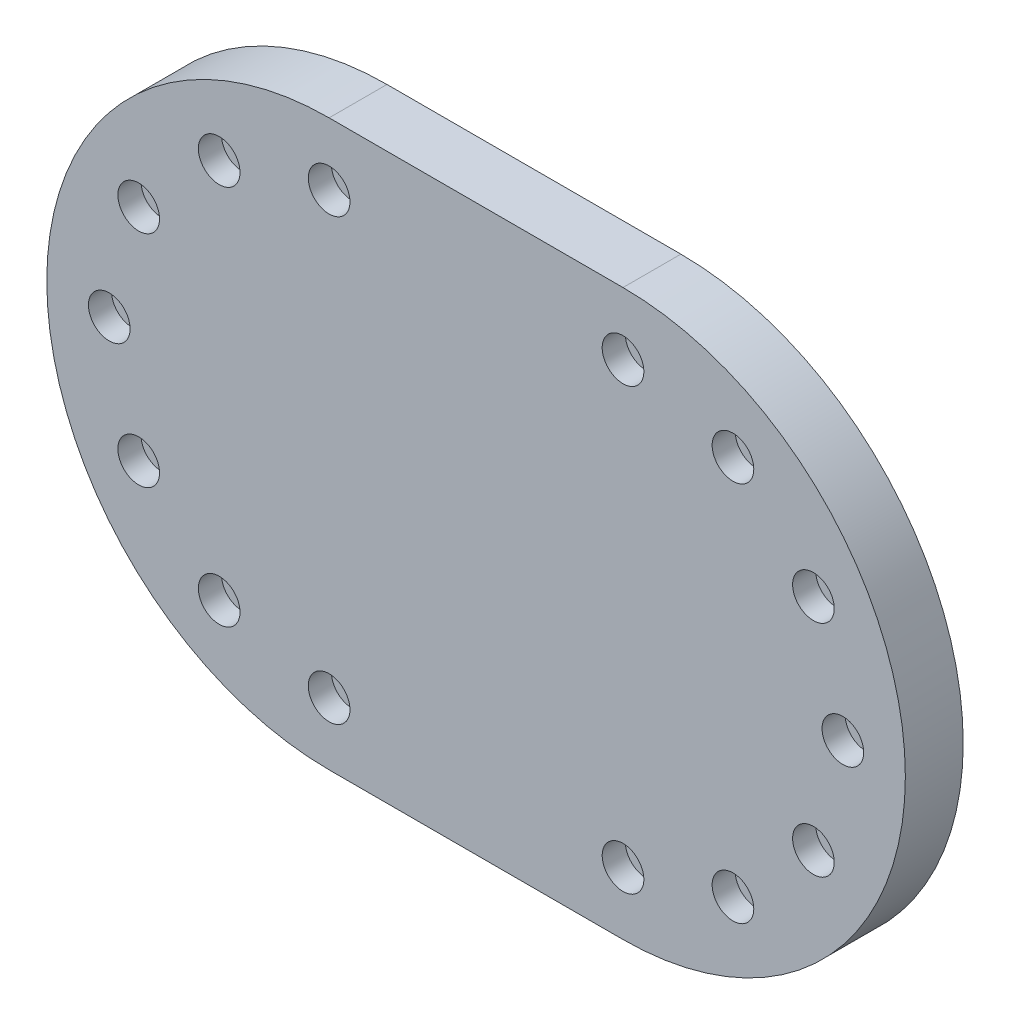
from build123d import *

# Parameters (mm, degrees)
RESSALTO_EXTRUS_O4_DEPTH = 12.5
CORTE_EXTRUS_O2_DEPTH    = 6.25
FURO5_D                  = 5
FURO5_CBORE_D            = 9
FURO5_CBORE_DEPTH        = 5
PADR_OCIRCULAR3_COUNT    = 7
PADR_OCIRCULAR3_ANGLE    = 180
FURO6_D                  = 5
FURO6_CBORE_D            = 9
FURO6_CBORE_DEPTH        = 5
PADR_OCIRCULAR4_COUNT    = 7
PADR_OCIRCULAR4_ANGLE    = 180


with BuildPart() as part:
    # Esboço1 → Ressalto-extrusão4 (new body)
    with BuildSketch(Plane.XY):
        with BuildLine():
            Line((31.75, 61), (-31.75, 61))
            ThreePointArc((-31.75, 61), (-92.75, 0), (-31.75, -61))
            Line((-31.75, -61), (31.75, -61))
            ThreePointArc((31.75, -61), (92.75, 0), (31.75, 61))
        make_face()
    extrude(amount=RESSALTO_EXTRUS_O4_DEPTH)

    # Esboço1<7> → Corte-extrusão2 (cut)
    with BuildSketch(Plane.XY):
        with BuildLine():
            Line((31.75, 11.5), (-31.75, 11.5))
            ThreePointArc((-31.75, 11.5), (-43.25, 0), (-31.75, -11.5))
            Line((-31.75, -11.5), (31.75, -11.5))
            ThreePointArc((31.75, -11.5), (43.25, 0), (31.75, 11.5))
        make_face()
    extrude(amount=CORTE_EXTRUS_O2_DEPTH, mode=Mode.SUBTRACT)

    # Furo5 (through all)
    with Locations(Plane.XY.offset(12.5)):
        with Locations((-31.75, 47.5)):
            furo5 = CounterBoreHole(FURO5_D / 2, FURO5_CBORE_D / 2, FURO5_CBORE_DEPTH)

    # PadrãoCircular3: Furo5 ×7 about axis
    padr_ocircular3_axis = Axis((-31.75, 0, 12.5), (0, 0, 1))
    for i in range(1, PADR_OCIRCULAR3_COUNT):
        add(furo5.rotate(padr_ocircular3_axis, i * PADR_OCIRCULAR3_ANGLE / (PADR_OCIRCULAR3_COUNT - 1)), mode=Mode.SUBTRACT)

    # Furo6 (through all)
    with Locations(Plane.XY.offset(12.5)):
        with Locations((31.75, 47.5)):
            furo6 = CounterBoreHole(FURO6_D / 2, FURO6_CBORE_D / 2, FURO6_CBORE_DEPTH)

    # PadrãoCircular4: Furo6 ×7 about axis
    padr_ocircular4_axis = Axis((31.75, 0, 12.5), (0, 0, -1))
    for i in range(1, PADR_OCIRCULAR4_COUNT):
        add(furo6.rotate(padr_ocircular4_axis, i * PADR_OCIRCULAR4_ANGLE / (PADR_OCIRCULAR4_COUNT - 1)), mode=Mode.SUBTRACT)


solid = part.part
